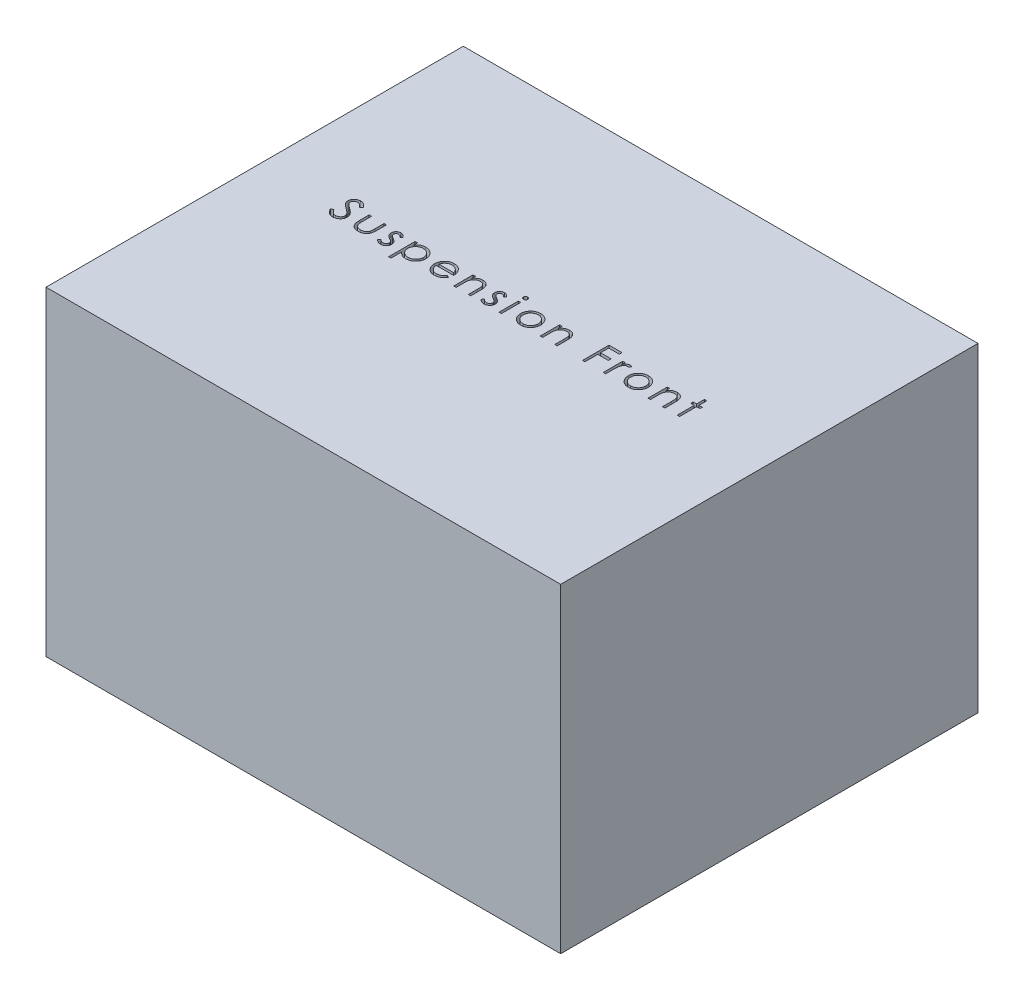
from build123d import *

# Parameters (mm, degrees)
BOSS_EXTRUDE1_DEPTH      = 115
BOSS_EXTRUDE1_DEPTH_BACK = 115
SKETCH1_W                = 370
SKETCH1_H                = 300
SKETCH2_W                = 1.709615384
SKETCH2_H                = 13.921153846
CUT_EXTRUDE1_DEPTH       = 30


with BuildPart() as part:
    # Sketch1 → Boss-Extrude1 (new, two sides: drawn at the far end of the back side and taken through both)
    with BuildSketch(Plane(origin=(0, 0, 0), x_dir=(1, 0, 0), z_dir=(0, 1, 0)).offset(-BOSS_EXTRUDE1_DEPTH_BACK)):
        Rectangle(SKETCH1_W, SKETCH1_H)
    extrude(amount=BOSS_EXTRUDE1_DEPTH + BOSS_EXTRUDE1_DEPTH_BACK)

    # Sketch2 → Cut-Extrude1 (cut)
    # profile 1 of 16: a face of its own
    with BuildSketch(Plane(origin=(0, 115, 0), x_dir=(1, 0, 0), z_dir=(0, 1, 0))):
        with BuildLine():
            Line((-131.479988393, 0.915421973), (-129.869591758, 1.880896732))
            add(Edge.make_bspline(
                [(-129.869591758, 1.880896732), (-129.719813924, 1.630174866), (-129.432845374, 1.149801445), (-128.95413869, 0.500696968), (-128.458115274, -0.051002771), (-127.941101901, -0.502088307), (-127.406254384, -0.857228676), (-126.850081177, -1.108700823), (-126.274456522, -1.26554206), (-125.882713293, -1.284592531), (-125.687139835, -1.294103268)],
                knots=[0, 0, 0, 0, 1.272034388, 2.437168799, 3.508375237, 4.49857839, 5.41946034, 6.295179144, 7.148887113, 8, 8, 8, 8], degree=3))
            add(Edge.make_bspline(
                [(-125.687139835, -1.294103268), (-125.520115637, -1.289451407), (-125.188989773, -1.280229083), (-124.701515279, -1.191615003), (-124.228085755, -1.055477559), (-123.778458741, -0.860509346), (-123.358838325, -0.624624159), (-122.99086474, -0.339711393), (-122.672750896, -0.020726188), (-122.412532715, 0.335142261), (-122.212888523, 0.717868456), (-122.059443122, 1.110711848), (-121.974289221, 1.519843627), (-121.961461749, 1.795309146), (-121.954988393, 1.934322213)],
                knots=[0, 0, 0, 0, 1.095163259, 2.171163733, 3.241058638, 4.321873601, 5.38011039, 6.391990106, 7.366004449, 8.327778327, 9.272591725, 10.192022065, 11.087607919, 12, 12, 12, 12], degree=3))
            add(Edge.make_bspline(
                [(-121.954988393, 1.934322213), (-121.963012855, 2.092931695), (-121.979325415, 2.415361595), (-122.117201042, 2.89106542), (-122.3340948, 3.361832123), (-122.534188618, 3.653031868), (-122.638071326, 3.80421404)],
                knots=[0, 0, 0, 0, 0.938893495, 1.908633276, 2.914225137, 4, 4, 4, 4], degree=3))
            add(Edge.make_bspline(
                [(-122.638071326, 3.80421404), (-122.72336424, 3.913326037), (-122.902426045, 4.142393027), (-123.210260506, 4.483362094), (-123.571481785, 4.835070917), (-123.973728277, 5.210949498), (-124.431652661, 5.593515935), (-124.930912418, 6.001013276), (-125.484254278, 6.417944717), (-125.872327253, 6.697558252), (-126.072566518, 6.841834232)],
                knots=[0, 0, 0, 0, 0.722233717, 1.516239348, 2.393582979, 3.351407094, 4.387010283, 5.505090956, 6.712668013, 8, 8, 8, 8], degree=3))
            add(Edge.make_bspline(
                [(-126.072566518, 6.841834232), (-126.272994269, 6.984592688), (-126.656196865, 7.257535984), (-127.192092864, 7.66261673), (-127.671306298, 8.032969791), (-128.091707231, 8.372081628), (-128.453110751, 8.679998234), (-128.758364745, 8.953762731), (-128.999693177, 9.20077897), (-129.13388998, 9.361023987), (-129.194141037, 9.43297005)],
                knots=[0, 0, 0, 0, 1.452282411, 2.77665338, 3.964542531, 5.026858415, 5.96415736, 6.766646006, 7.446254459, 8, 8, 8, 8], degree=3))
            add(Edge.make_bspline(
                [(-129.194141037, 9.43297005), (-129.278355891, 9.54509855), (-129.443975702, 9.765614295), (-129.662593532, 10.11028245), (-129.848408118, 10.463106223), (-129.994071668, 10.825033714), (-130.116733088, 11.190983827), (-130.199235539, 11.565731321), (-130.250895857, 11.947594659), (-130.256186241, 12.204570998), (-130.258834547, 12.333210434)],
                knots=[0, 0, 0, 0, 1.068054152, 2.10047183, 3.106115577, 4.101338837, 5.06977816, 6.043150881, 7.020423561, 8, 8, 8, 8], degree=3))
            add(Edge.make_bspline(
                [(-130.258834547, 12.333210434), (-130.251730481, 12.534758207), (-130.237674193, 12.933545811), (-130.118799378, 13.516099331), (-129.931168342, 14.072285402), (-129.668306167, 14.596597647), (-129.329448289, 15.075383915), (-128.937312342, 15.514151608), (-128.470252682, 15.88300632), (-127.957793404, 16.205289095), (-127.396872293, 16.457543345), (-126.809093233, 16.647830965), (-126.193522026, 16.755649925), (-125.776582108, 16.771122688), (-125.565024451, 16.778973656)],
                knots=[0, 0, 0, 0, 1.005424448, 1.989358655, 2.955360095, 3.929531133, 4.905563448, 5.876582895, 6.856512386, 7.866279853, 8.892233794, 9.918561126, 10.94386622, 12, 12, 12, 12], degree=3))
            add(Edge.make_bspline(
                [(-125.565024451, 16.778973656), (-125.340538705, 16.77123091), (-124.894108205, 16.755833062), (-124.23743176, 16.621952213), (-123.605185575, 16.40042427), (-123.096587233, 16.149026003), (-122.69853606, 15.897939298), (-122.394973044, 15.669231397), (-122.087356633, 15.405932592), (-121.773205506, 15.107341552), (-121.457842774, 14.770718521), (-121.136586555, 14.398368915), (-120.808685607, 13.992568232), (-120.597742996, 13.702874878), (-120.489603778, 13.554364281)],
                knots=[0, 0, 0, 0, 1.286793592, 2.559021753, 3.825965368, 5.121522368, 5.803751409, 6.523245864, 7.299691795, 8.125521123, 9.008227632, 9.944561021, 10.946284179, 12, 12, 12, 12], degree=3))
            Line((-120.489603778, 13.554364281), (-122.035126614, 12.382819809))
            add(Edge.make_bspline(
                [(-122.035126614, 12.382819809), (-122.128449475, 12.503045396), (-122.308167486, 12.734571765), (-122.581015121, 13.058809926), (-122.838182762, 13.35499105), (-123.091549938, 13.61224839), (-123.327735275, 13.844670002), (-123.556972319, 14.043659535), (-123.775962145, 14.211166705), (-124.052007045, 14.38992951), (-124.398813483, 14.567129907), (-124.834157887, 14.717075604), (-125.289106042, 14.807182441), (-125.598965893, 14.819096243), (-125.755829739, 14.825127502)],
                knots=[0, 0, 0, 0, 1.181633172, 2.275549214, 3.290209073, 4.226197932, 5.078386478, 5.862611352, 6.581680152, 7.217281963, 8.414376989, 9.595101626, 10.782541182, 12, 12, 12, 12], degree=3))
            add(Edge.make_bspline(
                [(-125.755829739, 14.825127502), (-125.952624525, 14.818532392), (-126.332124732, 14.805814344), (-126.870914446, 14.66691271), (-127.355839952, 14.448208584), (-127.772504628, 14.141694204), (-128.119415888, 13.778541372), (-128.370361314, 13.360645032), (-128.521401495, 12.899186527), (-128.539832532, 12.57728694), (-128.549219162, 12.413348656)],
                knots=[0, 0, 0, 0, 1.14458467, 2.207223713, 3.21896685, 4.227309161, 5.202851033, 6.127160689, 7.046193047, 8, 8, 8, 8], degree=3))
            add(Edge.make_bspline(
                [(-128.549219162, 12.413348656), (-128.54707943, 12.311287037), (-128.542796467, 12.106996908), (-128.483062211, 11.80518274), (-128.406321578, 11.504131021), (-128.284713825, 11.205195249), (-128.116827244, 10.90314738), (-127.896363358, 10.592786209), (-127.618705188, 10.271376194), (-127.406014592, 10.062330346), (-127.293720364, 9.951960434)],
                knots=[0, 0, 0, 0, 0.858281714, 1.717966888, 2.583508476, 3.4729293, 4.427298488, 5.488583878, 6.674047936, 8, 8, 8, 8], degree=3))
            add(Edge.make_bspline(
                [(-127.293720364, 9.951960434), (-127.252020609, 9.91474748), (-127.152951535, 9.826338017), (-126.971835424, 9.681600032), (-126.732661051, 9.503059229), (-126.441673928, 9.282148264), (-126.093508716, 9.025890591), (-125.688127132, 8.737562788), (-125.230047932, 8.40780479), (-124.904990075, 8.177258747), (-124.733113393, 8.055355867)],
                knots=[0, 0, 0, 0, 0.420754252, 0.999615792, 1.744751191, 2.668019286, 3.750313428, 4.999500688, 6.413464383, 8, 8, 8, 8], degree=3))
            add(Edge.make_bspline(
                [(-124.733113393, 8.055355867), (-124.526361493, 7.904907896), (-124.126015095, 7.613586251), (-123.556378839, 7.175895193), (-123.039885398, 6.747826624), (-122.57472139, 6.332114219), (-122.156291359, 5.931911313), (-121.78923748, 5.542403146), (-121.469819705, 5.166380243), (-121.125944245, 4.684292367), (-120.774565256, 4.092212465), (-120.472805051, 3.366798053), (-120.28253176, 2.638563794), (-120.257649654, 2.14910487), (-120.245373008, 1.907609473)],
                knots=[0, 0, 0, 0, 1.163667725, 2.253281268, 3.268753668, 4.215851969, 5.092017293, 5.902905408, 6.650798638, 7.335211899, 8.59617414, 9.77448103, 10.901945474, 12, 12, 12, 12], degree=3))
            add(Edge.make_bspline(
                [(-120.245373008, 1.907609473), (-120.248949717, 1.736821514), (-120.256033678, 1.398562184), (-120.337463794, 0.901873837), (-120.4567694, 0.419468675), (-120.636586345, -0.04269038), (-120.856059535, -0.493058303), (-121.134550113, -0.919821304), (-121.457353368, -1.332424702), (-121.827651432, -1.719866276), (-122.232849843, -2.075536286), (-122.661113952, -2.391924463), (-123.113144724, -2.655730623), (-123.586489961, -2.871000206), (-124.081258394, -3.039366923), (-124.597283618, -3.161356968), (-125.135416243, -3.236227337), (-125.501178864, -3.243998439), (-125.687139835, -3.247949421)],
                knots=[0, 0, 0, 0, 0.983748083, 1.948392443, 2.894712957, 3.844097841, 4.80183111, 5.778335162, 6.776009319, 7.81870978, 8.863265674, 9.881300176, 10.883814829, 11.87499822, 12.874611388, 13.892143829, 14.928324115, 16, 16, 16, 16], degree=3))
            add(Edge.make_bspline(
                [(-125.687139835, -3.247949421), (-125.831023631, -3.245167133), (-126.116979153, -3.239637596), (-126.539940762, -3.19075377), (-126.954357669, -3.12159082), (-127.355029689, -3.01178624), (-127.74711903, -2.87856155), (-128.128920406, -2.714522911), (-128.500618857, -2.517942143), (-128.864297415, -2.293179224), (-129.219031137, -2.031607785), (-129.561492812, -1.726952041), (-129.902918807, -1.387614363), (-130.233231636, -1.004379726), (-130.559112607, -0.583439589), (-130.874136522, -0.120855605), (-131.184824157, 0.380852563), (-131.379762632, 0.733903958), (-131.479988393, 0.915421973)],
                knots=[0, 0, 0, 0, 0.915332311, 1.819136955, 2.706846663, 3.586547465, 4.459518054, 5.340707479, 6.227863349, 7.133153174, 8.059268498, 9.028702269, 10.047606654, 11.120612155, 12.245963614, 13.433783089, 14.680604001, 16, 16, 16, 16], degree=3))
        make_face()
    # profile 2 of 16: a face of its own
    with BuildSketch(Plane(origin=(0, 115, 0), x_dir=(1, 0, 0), z_dir=(0, 1, 0))):
        with BuildLine():
            Line((-113.846526854, 11.161665963), (-112.13691147, 11.161665963))
            Line((-112.13691147, 11.161665963), (-112.13691147, 4.704815002))
            add(Edge.make_bspline(
                [(-112.13691147, 4.704815002), (-112.136139102, 4.515279753), (-112.134661598, 4.152707699), (-112.124641619, 3.630981611), (-112.101073538, 3.155184932), (-112.071606865, 2.725042808), (-112.033712953, 2.340628005), (-111.988627805, 2.003283219), (-111.938235538, 1.709182874), (-111.888908481, 1.532054038), (-111.86596796, 1.449676781)],
                knots=[0, 0, 0, 0, 1.388932606, 2.656963016, 3.823490214, 4.879454478, 5.816252168, 6.653371382, 7.373723809, 8, 8, 8, 8], degree=3))
            add(Edge.make_bspline(
                [(-111.86596796, 1.449676781), (-111.829166327, 1.346138011), (-111.756328156, 1.141213019), (-111.624211052, 0.845181433), (-111.460771106, 0.570995968), (-111.281919757, 0.3080838), (-111.075638695, 0.064232986), (-110.84453786, -0.160144683), (-110.59635317, -0.373526951), (-110.227572257, -0.625992747), (-109.723241109, -0.896586187), (-109.061102541, -1.130061998), (-108.343166683, -1.269594105), (-107.846970139, -1.28578255), (-107.591929499, -1.294103268)],
                knots=[0, 0, 0, 0, 0.725840625, 1.436591201, 2.137033971, 2.831655856, 3.53531722, 4.242432219, 4.957935707, 5.694543706, 7.190802206, 8.724350549, 10.316345118, 12, 12, 12, 12], degree=3))
            add(Edge.make_bspline(
                [(-107.591929499, -1.294103268), (-107.33691255, -1.285605614), (-106.843501938, -1.269164228), (-106.133454176, -1.134270968), (-105.484385764, -0.908905718), (-104.9028113, -0.594268234), (-104.391368656, -0.209229292), (-103.965168891, 0.242575796), (-103.613520834, 0.746853173), (-103.459980987, 1.123086748), (-103.382764835, 1.312296973)],
                knots=[0, 0, 0, 0, 1.157059328, 2.238695713, 3.266970494, 4.264342957, 5.228770407, 6.160125903, 7.074715775, 8, 8, 8, 8], degree=3))
            add(Edge.make_bspline(
                [(-103.382764835, 1.312296973), (-103.35993624, 1.388313541), (-103.309467792, 1.556367609), (-103.255244136, 1.841463096), (-103.206397423, 2.181449016), (-103.16468785, 2.578550123), (-103.134941751, 3.031728681), (-103.118906949, 3.540843067), (-103.100791622, 4.104295042), (-103.10051667, 4.498726703), (-103.100373008, 4.704815002)],
                knots=[0, 0, 0, 0, 0.557542046, 1.232589297, 2.036731608, 2.971723315, 4.038036528, 5.22795436, 6.551621927, 8, 8, 8, 8], degree=3))
            Line((-103.100373008, 4.704815002), (-103.100373008, 11.161665963))
            Line((-103.100373008, 11.161665963), (-101.390757624, 11.161665963))
            Line((-101.390757624, 11.161665963), (-101.390757624, 4.384262117))
            add(Edge.make_bspline(
                [(-101.390757624, 4.384262117), (-101.393161706, 4.153990227), (-101.397825953, 3.70723126), (-101.427801637, 3.057984882), (-101.479234529, 2.452944663), (-101.557299714, 1.891790338), (-101.649097172, 1.37495033), (-101.767513457, 0.901762232), (-101.908909294, 0.473683945), (-102.068415026, 0.083203702), (-102.256856905, -0.270837251), (-102.457301116, -0.606856481), (-102.688757374, -0.9165166), (-102.932435364, -1.215232232), (-103.203498662, -1.488145403), (-103.496867894, -1.741518435), (-103.80841388, -1.979224508), (-104.145050229, -2.191992758), (-104.501862514, -2.383671927), (-104.879291222, -2.553576581), (-105.281959226, -2.688029179), (-105.704671307, -2.804020088), (-106.149498492, -2.894994556), (-106.616011945, -2.959147155), (-107.104054528, -2.998473599), (-107.436664587, -3.001940943), (-107.607193922, -3.003718652)],
                knots=[0, 0, 0, 0, 1.493040784, 2.896703357, 4.213163133, 5.428574705, 6.569057535, 7.615249723, 8.588095153, 9.490268104, 10.346124644, 11.18633936, 12.024365274, 12.850166724, 13.684164916, 14.514361689, 15.362232829, 16.222528818, 17.093394965, 17.986930858, 18.902426812, 19.842810585, 20.827885679, 21.843828298, 22.894529745, 24, 24, 24, 24], degree=3))
            add(Edge.make_bspline(
                [(-107.607193922, -3.003718652), (-107.776447806, -3.001869675), (-108.109047444, -2.998236262), (-108.597115216, -2.959364423), (-109.064921202, -2.895094237), (-109.510802228, -2.803353697), (-109.935205733, -2.688841044), (-110.339850811, -2.552750373), (-110.719999346, -2.383583751), (-111.080218539, -2.193205902), (-111.417688681, -1.97785776), (-111.73396537, -1.741811716), (-112.028624525, -1.485420144), (-112.301731138, -1.209753815), (-112.549451768, -0.911393061), (-112.774873366, -0.59273794), (-112.98146629, -0.256945829), (-113.16844362, 0.102626526), (-113.32907189, 0.497625608), (-113.470886871, 0.934671237), (-113.586877631, 1.418554935), (-113.681270209, 1.948863003), (-113.757205907, 2.523057444), (-113.809926195, 3.144459818), (-113.839403789, 3.811556486), (-113.844101309, 4.272293744), (-113.846526854, 4.510193607)],
                knots=[0, 0, 0, 0, 1.083640291, 2.129454052, 3.13281866, 4.105697902, 5.042300162, 5.946461698, 6.836384745, 7.703652036, 8.553297018, 9.397182691, 10.228592656, 11.052265423, 11.879314572, 12.708807002, 13.549817954, 14.402308542, 15.300838682, 16.27712199, 17.341985831, 18.484375296, 19.725102775, 21.0496083, 22.476576903, 24, 24, 24, 24], degree=3))
            Line((-113.846526854, 4.510193607), (-113.846526854, 11.161665963))
        make_face()
    # profile 3 of 16: a face of its own
    with BuildSketch(Plane(origin=(0, 115, 0), x_dir=(1, 0, 0), z_dir=(0, 1, 0))):
        with BuildLine():
            Line((-87.664988393, 9.425337838), (-88.825084547, 8.230896732))
            add(Edge.make_bspline(
                [(-88.825084547, 8.230896732), (-88.92518143, 8.346901143), (-89.118156438, 8.570543991), (-89.424216356, 8.869558595), (-89.729144827, 9.120675363), (-90.028767655, 9.332686944), (-90.330619091, 9.492974442), (-90.631156888, 9.609967905), (-90.930692222, 9.682367732), (-91.130913357, 9.691699177), (-91.229231181, 9.696281348)],
                knots=[0, 0, 0, 0, 1.26578478, 2.440284043, 3.530471711, 4.527705817, 5.468200915, 6.346673037, 7.188140097, 8, 8, 8, 8], degree=3))
            add(Edge.make_bspline(
                [(-91.229231181, 9.696281348), (-91.349732718, 9.690430968), (-91.586862687, 9.678918248), (-91.926637498, 9.564000863), (-92.242054471, 9.387604729), (-92.515051748, 9.137404296), (-92.746306121, 8.850215918), (-92.915109156, 8.52910735), (-93.018338296, 8.183768712), (-93.031426909, 7.944120487), (-93.038065316, 7.822573415)],
                knots=[0, 0, 0, 0, 0.99966794, 1.967205029, 2.953328237, 3.988086729, 5.028030931, 6.008226631, 6.989793394, 8, 8, 8, 8], degree=3))
            add(Edge.make_bspline(
                [(-93.038065316, 7.822573415), (-93.032019324, 7.712562146), (-93.019944382, 7.492849729), (-92.926073171, 7.168738287), (-92.776579264, 6.852742122), (-92.636860064, 6.659178304), (-92.564868201, 6.559442406)],
                knots=[0, 0, 0, 0, 0.960159726, 1.917612774, 2.927026955, 4, 4, 4, 4], degree=3))
            add(Edge.make_bspline(
                [(-92.564868201, 6.559442406), (-92.521524042, 6.506186311), (-92.429271462, 6.392837425), (-92.256142259, 6.23551788), (-92.060076922, 6.061660771), (-91.82429269, 5.88783313), (-91.558947809, 5.704780454), (-91.258288277, 5.519711702), (-90.931855614, 5.318519618), (-90.698153988, 5.190914905), (-90.576677095, 5.124586636)],
                knots=[0, 0, 0, 0, 0.66740084, 1.420478572, 2.27185888, 3.217733974, 4.268547843, 5.408967954, 6.65319498, 8, 8, 8, 8], degree=3))
            add(Edge.make_bspline(
                [(-90.576677095, 5.124586636), (-90.428557482, 5.041610808), (-90.142439164, 4.88132883), (-89.735897102, 4.632537444), (-89.366941922, 4.385260692), (-89.032447502, 4.142143101), (-88.738849943, 3.896382493), (-88.477241449, 3.657398845), (-88.254147204, 3.417971324), (-88.12921226, 3.250695377), (-88.069495604, 3.170740482)],
                knots=[0, 0, 0, 0, 1.27191281, 2.456916733, 3.569705269, 4.599008579, 5.553216877, 6.436649441, 7.252746552, 8, 8, 8, 8], degree=3))
            add(Edge.make_bspline(
                [(-88.069495604, 3.170740482), (-87.970378305, 3.009272203), (-87.773116484, 2.68792036), (-87.565970777, 2.158774347), (-87.445899852, 1.597558613), (-87.429232625, 1.213661815), (-87.420757624, 1.018456829)],
                knots=[0, 0, 0, 0, 0.995354457, 1.980940102, 2.973342416, 4, 4, 4, 4], degree=3))
            add(Edge.make_bspline(
                [(-87.420757624, 1.018456829), (-87.424673943, 0.880920475), (-87.432391479, 0.609890067), (-87.486047529, 0.210739065), (-87.578331043, -0.170993312), (-87.704027047, -0.539449076), (-87.873759134, -0.887568447), (-88.072683573, -1.224134317), (-88.311488449, -1.541866169), (-88.584128651, -1.840346795), (-88.88264484, -2.112956363), (-89.201085393, -2.352572455), (-89.539842456, -2.551641347), (-89.896495476, -2.716371298), (-90.271854793, -2.847371387), (-90.665979096, -2.938063165), (-91.077615603, -2.992343479), (-91.357540701, -2.999878985), (-91.500174691, -3.003718652)],
                knots=[0, 0, 0, 0, 1.032770009, 2.035186124, 3.017557409, 3.978232242, 4.952395191, 5.920591857, 6.910227898, 7.931268572, 8.952309245, 9.941945286, 10.918353717, 11.897095711, 12.887975737, 13.898235213, 14.929059601, 16, 16, 16, 16], degree=3))
            add(Edge.make_bspline(
                [(-91.500174691, -3.003718652), (-91.692673174, -2.998315526), (-92.074995391, -2.98758435), (-92.640452291, -2.886858503), (-93.193015277, -2.730129287), (-93.728502833, -2.513961131), (-94.234939538, -2.240997965), (-94.698294999, -1.914086937), (-95.120178816, -1.544027094), (-95.360308278, -1.260383966), (-95.480373008, -1.118562402)],
                knots=[0, 0, 0, 0, 1.013940152, 2.01379169, 3.017749504, 4.037548394, 5.051665909, 6.043208538, 7.021604269, 8, 8, 8, 8], degree=3))
            Line((-95.480373008, -1.118562402), (-94.346989595, 0.171281348))
            add(Edge.make_bspline(
                [(-94.346989595, 0.171281348), (-94.239371176, 0.055050415), (-94.030736598, -0.170280822), (-93.697082832, -0.470314734), (-93.357560663, -0.721781652), (-93.015560441, -0.932112238), (-92.666019641, -1.094175504), (-92.310897084, -1.208032422), (-91.95091509, -1.28120724), (-91.709131751, -1.289797605), (-91.587945124, -1.294103268)],
                knots=[0, 0, 0, 0, 1.179806542, 2.287233372, 3.337373186, 4.324005949, 5.273901747, 6.200048787, 7.097828587, 8, 8, 8, 8], degree=3))
            add(Edge.make_bspline(
                [(-91.587945124, -1.294103268), (-91.422928984, -1.286642064), (-91.100515128, -1.272064123), (-90.63872267, -1.139709665), (-90.212336717, -0.932173784), (-89.842095365, -0.637798498), (-89.526942174, -0.29514031), (-89.298733111, 0.09083511), (-89.155715642, 0.508800039), (-89.138918992, 0.798535857), (-89.130373008, 0.945950819)],
                knots=[0, 0, 0, 0, 1.072336372, 2.095165389, 3.102688358, 4.141489647, 5.156069229, 6.117746104, 7.042326257, 8, 8, 8, 8], degree=3))
            add(Edge.make_bspline(
                [(-89.130373008, 0.945950819), (-89.136285553, 1.067378886), (-89.147959082, 1.307122351), (-89.239634605, 1.65410635), (-89.384484558, 1.983232006), (-89.527112716, 2.1758528), (-89.599754018, 2.273955627)],
                knots=[0, 0, 0, 0, 1.013901739, 2.00181326, 2.98231254, 4, 4, 4, 4], degree=3))
            add(Edge.make_bspline(
                [(-89.599754018, 2.273955627), (-89.643418765, 2.323133812), (-89.738536353, 2.430261661), (-89.913008452, 2.584975305), (-90.121915445, 2.751734102), (-90.367606903, 2.927710321), (-90.650578118, 3.11058273), (-90.971975977, 3.299391919), (-91.327397555, 3.503105684), (-91.578697706, 3.638195522), (-91.710060508, 3.708811396)],
                knots=[0, 0, 0, 0, 0.615000592, 1.339693406, 2.178160186, 3.116406724, 4.166410947, 5.330106347, 6.604359322, 8, 8, 8, 8], degree=3))
            add(Edge.make_bspline(
                [(-91.710060508, 3.708811396), (-91.851828649, 3.787945813), (-92.126762318, 3.941412701), (-92.516184001, 4.180441652), (-92.867506029, 4.423559247), (-93.189182014, 4.657127701), (-93.473086916, 4.893461696), (-93.718102292, 5.132823593), (-93.933874652, 5.365560089), (-94.053331279, 5.530463946), (-94.110391037, 5.609232069)],
                knots=[0, 0, 0, 0, 1.262093308, 2.447601706, 3.550203992, 4.582594899, 5.537233252, 6.418365656, 7.244515135, 8, 8, 8, 8], degree=3))
            add(Edge.make_bspline(
                [(-94.110391037, 5.609232069), (-94.209073301, 5.767867488), (-94.406472314, 6.085193762), (-94.598143569, 6.614840786), (-94.729893526, 7.172434598), (-94.741663107, 7.557173048), (-94.747680701, 7.753883511)],
                knots=[0, 0, 0, 0, 0.985009483, 1.970363186, 2.962279964, 4, 4, 4, 4], degree=3))
            add(Edge.make_bspline(
                [(-94.747680701, 7.753883511), (-94.744773152, 7.882473177), (-94.739082667, 8.134141372), (-94.693667186, 8.503922665), (-94.610980872, 8.855249046), (-94.507267651, 9.193396686), (-94.363124441, 9.511815226), (-94.1908803, 9.81475089), (-93.988474459, 10.101784958), (-93.755284547, 10.368502005), (-93.498889806, 10.61075991), (-93.221876845, 10.821935299), (-92.930475763, 11.002128459), (-92.623452794, 11.153250262), (-92.297858505, 11.267557787), (-91.955968774, 11.346247268), (-91.598475631, 11.398799158), (-91.354085217, 11.403496802), (-91.229231181, 11.405896732)],
                knots=[0, 0, 0, 0, 1.087655834, 2.128696564, 3.144119009, 4.137814668, 5.115653402, 6.093965665, 7.082169637, 8.081268856, 9.086088321, 10.061021666, 11.022561449, 11.980240094, 12.950172527, 13.934149372, 14.944599409, 16, 16, 16, 16], degree=3))
            add(Edge.make_bspline(
                [(-91.229231181, 11.405896732), (-91.081228665, 11.399885964), (-90.782447257, 11.387751671), (-90.334202793, 11.291382126), (-89.886618459, 11.132814802), (-89.438544226, 10.913814732), (-88.993262508, 10.630422165), (-88.546856474, 10.287906979), (-88.093967052, 9.888522561), (-87.811176262, 9.583182491), (-87.664988393, 9.425337838)],
                knots=[0, 0, 0, 0, 0.845714091, 1.707292901, 2.609013841, 3.555613372, 4.552488639, 5.621697636, 6.770543573, 8, 8, 8, 8], degree=3))
        make_face()
    # profile 4 of 16: a face of its own
    with BuildSketch(Plane(origin=(0, 115, 0), x_dir=(1, 0, 0), z_dir=(0, 1, 0))):
        with BuildLine():
            Line((-80.777680701, 11.161665963), (-79.068065316, 11.161665963))
            Line((-79.068065316, 11.161665963), (-79.068065316, 8.585794569))
            add(Edge.make_bspline(
                [(-79.068065316, 8.585794569), (-78.886505296, 8.81949852), (-78.53367973, 9.27365538), (-77.925577034, 9.861430223), (-77.28371826, 10.35714009), (-76.591585971, 10.745665019), (-75.85993703, 11.03860401), (-75.091773988, 11.255117873), (-74.280577282, 11.38270647), (-73.725969447, 11.398064369), (-73.443125412, 11.405896732)],
                knots=[0, 0, 0, 0, 1.0828784, 2.104357462, 3.088488658, 4.04616522, 5.001424249, 5.969181776, 6.964304535, 8, 8, 8, 8], degree=3))
            add(Edge.make_bspline(
                [(-73.443125412, 11.405896732), (-73.1960654, 11.398749287), (-72.707738308, 11.384621987), (-71.98893702, 11.288974361), (-71.296739575, 11.125048064), (-70.635062024, 10.888823081), (-69.996815912, 10.596784024), (-69.391449912, 10.228209873), (-68.809534702, 9.801456177), (-68.265705158, 9.310335471), (-67.763213143, 8.778958763), (-67.328621786, 8.207337365), (-66.95376185, 7.614269574), (-66.650756379, 6.990561186), (-66.413402374, 6.341123663), (-66.244593914, 5.663333149), (-66.144131597, 4.959702674), (-66.130652625, 4.481260723), (-66.123834547, 4.239250098)],
                knots=[0, 0, 0, 0, 1.041296284, 2.058176809, 3.050446431, 4.034000596, 5.01514041, 6.003636468, 7.015969324, 8.052561599, 9.08815499, 10.094063707, 11.074456064, 12.040834395, 13.011057502, 13.983766392, 14.980127149, 16, 16, 16, 16], degree=3))
            add(Edge.make_bspline(
                [(-66.123834547, 4.239250098), (-66.13050469, 3.992131818), (-66.143659174, 3.50477891), (-66.245685563, 2.789113423), (-66.40873655, 2.100660717), (-66.643096089, 1.440565897), (-66.945944762, 0.809283452), (-67.314451012, 0.207268639), (-67.74926164, -0.365285659), (-68.246200635, -0.900606444), (-68.785331615, -1.393725562), (-69.361607665, -1.825007055), (-69.966085531, -2.187182255), (-70.595672613, -2.489712363), (-71.255758588, -2.717725536), (-71.943263714, -2.882196708), (-72.657813682, -2.983621606), (-73.143867095, -2.996968267), (-73.389699931, -3.003718652)],
                knots=[0, 0, 0, 0, 1.038740735, 2.04854663, 3.033179607, 4.009277356, 4.987731542, 5.972001279, 6.972200261, 8.005528982, 9.039189865, 10.040446548, 11.026516639, 11.997840187, 12.972163198, 13.956796175, 14.96660207, 16, 16, 16, 16], degree=3))
            add(Edge.make_bspline(
                [(-73.389699931, -3.003718652), (-73.666347144, -2.996671199), (-74.212806497, -2.982750412), (-75.011805246, -2.841674766), (-75.780754968, -2.630835159), (-76.511136457, -2.322230637), (-77.208735551, -1.928954186), (-77.869606208, -1.449382922), (-78.49725882, -0.884519807), (-78.875040771, -0.455993779), (-79.068065316, -0.237041969)],
                knots=[0, 0, 0, 0, 1.014726462, 2.004382257, 2.969841629, 3.936926163, 4.907207904, 5.903978561, 6.929055279, 8, 8, 8, 8], degree=3))
            Line((-79.068065316, -0.237041969), (-79.068065316, -7.888334037))
            Line((-79.068065316, -7.888334037), (-80.777680701, -7.888334037))
            Line((-80.777680701, -7.888334037), (-80.777680701, 11.161665963))
        make_face()
        with BuildLine():
            add(Edge.make_bspline(
                [(-73.458389835, 9.696281348), (-73.652044311, 9.692796514), (-74.033300059, 9.685935774), (-74.592130279, 9.60443471), (-75.130403965, 9.48611929), (-75.6426963, 9.306984519), (-76.133917513, 9.08709955), (-76.600284181, 8.812333174), (-77.041468942, 8.487655828), (-77.456361778, 8.119286828), (-77.831174847, 7.713387454), (-78.162987355, 7.280202379), (-78.441701401, 6.82028019), (-78.673033826, 6.337905003), (-78.849073693, 5.829295665), (-78.974018396, 5.297348839), (-79.052560745, 4.74148229), (-79.062841961, 4.362898883), (-79.068065316, 4.170560194)],
                knots=[0, 0, 0, 0, 1.05670511, 2.080379991, 3.077984906, 4.06214886, 5.038337365, 6.01289324, 7.01187578, 8.025460281, 9.038092164, 10.024533457, 11.000252242, 11.969694649, 12.940728589, 13.933144304, 14.949937299, 16, 16, 16, 16], degree=3))
            add(Edge.make_bspline(
                [(-79.068065316, 4.170560194), (-79.059406514, 3.918076324), (-79.042443186, 3.42343904), (-78.904535512, 2.700714034), (-78.680097861, 2.016810023), (-78.361534433, 1.377486379), (-77.95904835, 0.789751233), (-77.474099813, 0.263478075), (-76.911076786, -0.198024999), (-76.279339642, -0.58676068), (-75.60212776, -0.902381441), (-74.895721581, -1.128337358), (-74.169835587, -1.267523344), (-73.679062304, -1.285195316), (-73.431677095, -1.294103268)],
                knots=[0, 0, 0, 0, 1.03728447, 2.032128127, 3.01272805, 3.987917167, 4.958271349, 5.931593992, 6.91984656, 7.941419022, 8.973179163, 9.983609215, 10.983593296, 12, 12, 12, 12], degree=3))
            add(Edge.make_bspline(
                [(-73.431677095, -1.294103268), (-73.189275272, -1.285632131), (-72.708151232, -1.268818446), (-71.999719171, -1.123286311), (-71.311248696, -0.900972677), (-70.657125186, -0.57679852), (-70.043043059, -0.179524062), (-69.488516318, 0.29705269), (-69.004064403, 0.849447953), (-68.591145556, 1.46453709), (-68.258415614, 2.124077392), (-68.00842388, 2.806510379), (-67.864141503, 3.509430467), (-67.843693839, 3.98294659), (-67.833449931, 4.220169569)],
                knots=[0, 0, 0, 0, 1.00104056, 1.986885549, 2.97790532, 3.984399681, 4.995088187, 5.994304198, 6.996462723, 8.023150851, 9.048424203, 10.043036403, 11.019596776, 12, 12, 12, 12], degree=3))
            add(Edge.make_bspline(
                [(-67.833449931, 4.220169569), (-67.84136784, 4.45886601), (-67.857141968, 4.934399205), (-68.012519416, 5.635237292), (-68.246017866, 6.320427562), (-68.586517849, 6.970960839), (-68.990384759, 7.584774061), (-69.478864842, 8.126631602), (-70.026504426, 8.601089121), (-70.639855447, 8.993058709), (-71.298116905, 9.304855474), (-71.991073805, 9.532822137), (-72.715211126, 9.669839259), (-73.208484503, 9.687389787), (-73.458389835, 9.696281348)],
                knots=[0, 0, 0, 0, 0.983928682, 1.960191568, 2.949917689, 3.96440592, 4.982380491, 5.975291189, 6.965713506, 7.964880129, 8.970154049, 9.96478489, 10.968906225, 12, 12, 12, 12], degree=3))
        make_face(mode=Mode.SUBTRACT)
    # profile 5 of 16: a face of its own
    with BuildSketch(Plane(origin=(0, 115, 0), x_dir=(1, 0, 0), z_dir=(0, 1, 0))):
        with BuildLine():
            Line((-48.055336951, 1.636665963), (-46.536526854, 0.839099857))
            add(Edge.make_bspline(
                [(-46.536526854, 0.839099857), (-46.657557466, 0.62441544), (-46.893035106, 0.20672458), (-47.297987748, -0.367125974), (-47.722487458, -0.883368542), (-48.185696198, -1.328211375), (-48.67375545, -1.716022484), (-49.189371757, -2.055318359), (-49.735229465, -2.344434877), (-50.311354396, -2.588016493), (-50.92258481, -2.775302453), (-51.57040192, -2.907586856), (-52.256046774, -2.989356361), (-52.726016696, -2.998854913), (-52.966665076, -3.003718652)],
                knots=[0, 0, 0, 0, 1.120438281, 2.179929193, 3.190490725, 4.156257408, 5.095198341, 6.022838206, 6.959905092, 7.901321166, 8.864066838, 9.862729781, 10.905609505, 12, 12, 12, 12], degree=3))
            add(Edge.make_bspline(
                [(-52.966665076, -3.003718652), (-53.234137839, -2.997474741), (-53.755899713, -2.985294678), (-54.515394623, -2.880288551), (-55.230474028, -2.708988998), (-55.901097728, -2.469690837), (-56.525623417, -2.157122116), (-57.105292355, -1.77634265), (-57.643152918, -1.329308521), (-58.122256113, -0.812147593), (-58.553569246, -0.258707226), (-58.934165495, 0.317995517), (-59.252340941, 0.916509639), (-59.511163005, 1.53302492), (-59.720195199, 2.16365554), (-59.865882544, 2.814139385), (-59.949864458, 3.482715922), (-59.962733797, 3.93500285), (-59.969219162, 4.162927982)],
                knots=[0, 0, 0, 0, 1.145258523, 2.234067595, 3.276747158, 4.290159414, 5.277019952, 6.260822364, 7.254936242, 8.264827045, 9.274100331, 10.257902744, 11.220704747, 12.172965371, 13.118907548, 14.062713208, 15.023725156, 16, 16, 16, 16], degree=3))
            add(Edge.make_bspline(
                [(-59.969219162, 4.162927982), (-59.963454407, 4.376804131), (-59.952029424, 4.800678413), (-59.880016139, 5.428052305), (-59.752390429, 6.037807168), (-59.577259294, 6.630449664), (-59.351101797, 7.204987507), (-59.07442929, 7.761770368), (-58.746810777, 8.300205772), (-58.493866652, 8.639857114), (-58.366454739, 8.810944809)],
                knots=[0, 0, 0, 0, 1.024358464, 2.0301432, 3.019427413, 4.004406732, 4.986367066, 5.972626655, 6.978780325, 8, 8, 8, 8], degree=3))
            add(Edge.make_bspline(
                [(-58.366454739, 8.810944809), (-58.193874351, 9.017059659), (-57.854180485, 9.422760164), (-57.279652322, 9.95582448), (-56.657532682, 10.402377028), (-55.995617974, 10.772530154), (-55.286215165, 11.053782433), (-54.53886031, 11.263373702), (-53.745043619, 11.380819734), (-53.202362346, 11.397408657), (-52.924687912, 11.405896732)],
                knots=[0, 0, 0, 0, 1.030682036, 2.02871468, 2.997146059, 3.962720338, 4.930598197, 5.918074684, 6.934738563, 8, 8, 8, 8], degree=3))
            add(Edge.make_bspline(
                [(-52.924687912, 11.405896732), (-52.639223089, 11.398526838), (-52.079206179, 11.384068784), (-51.262602777, 11.25003117), (-50.489930877, 11.037473694), (-49.761499675, 10.737279492), (-49.077235319, 10.349968217), (-48.441585535, 9.870224765), (-47.843679445, 9.312777748), (-47.49583418, 8.884080851), (-47.318828537, 8.66593279)],
                knots=[0, 0, 0, 0, 1.056321875, 2.072262726, 3.055038591, 4.01806755, 4.982017516, 5.957941055, 6.960871419, 8, 8, 8, 8], degree=3))
            add(Edge.make_bspline(
                [(-47.318828537, 8.66593279), (-47.198394773, 8.501539011), (-46.958328888, 8.173845708), (-46.657626815, 7.639514125), (-46.396601565, 7.080475033), (-46.187960734, 6.487691844), (-46.019017163, 5.868188129), (-45.896787907, 5.217535136), (-45.825107554, 4.535926618), (-45.811017645, 4.071506366), (-45.803834547, 3.834742886)],
                knots=[0, 0, 0, 0, 0.94817472, 1.890038105, 2.849395472, 3.817997239, 4.812318967, 5.836947057, 6.897266129, 8, 8, 8, 8], degree=3))
            Line((-45.803834547, 3.834742886), (-58.259603778, 3.834742886))
            add(Edge.make_bspline(
                [(-58.259603778, 3.834742886), (-58.25122392, 3.651316074), (-58.234745267, 3.290614645), (-58.157918559, 2.762816525), (-58.036821662, 2.26004162), (-57.866628621, 1.786061063), (-57.660524792, 1.334684226), (-57.408053962, 0.909259425), (-57.106848676, 0.511724406), (-56.770884512, 0.138523271), (-56.396921607, -0.193821729), (-56.00349694, -0.49128354), (-55.584976251, -0.740596859), (-55.144659539, -0.942961687), (-54.683258823, -1.101383208), (-54.200628732, -1.209520917), (-53.697718985, -1.281949599), (-53.354896632, -1.290003205), (-53.180366999, -1.294103268)],
                knots=[0, 0, 0, 0, 1.094153842, 2.151609401, 3.174256925, 4.172055639, 5.149267565, 6.128595816, 7.11444997, 8.118368179, 9.117203808, 10.09244225, 11.054858984, 12.015122123, 12.976791628, 13.957293641, 14.960065497, 16, 16, 16, 16], degree=3))
            add(Edge.make_bspline(
                [(-53.180366999, -1.294103268), (-53.009727181, -1.290793702), (-52.671145049, -1.284226889), (-52.166914097, -1.220371774), (-51.670854669, -1.117119274), (-51.185019889, -0.976203756), (-50.719269999, -0.804335461), (-50.287947791, -0.59694705), (-49.891271189, -0.367532), (-49.52052027, -0.105133626), (-49.160905292, 0.216039506), (-48.804166902, 0.616828216), (-48.421661117, 1.090833189), (-48.182232048, 1.447588885), (-48.055336951, 1.636665963)],
                knots=[0, 0, 0, 0, 0.99110716, 1.966546729, 2.947904876, 3.932708344, 4.903319531, 5.828989031, 6.710028674, 7.56322171, 8.463672341, 9.504779593, 10.677557249, 12, 12, 12, 12], degree=3))
        make_face()
        with BuildLine():
            add(Edge.make_bspline(
                [(-47.513449931, 5.544358271), (-47.576024416, 5.771123341), (-47.696460157, 6.207573104), (-47.948118084, 6.811952808), (-48.231536041, 7.349096955), (-48.566934322, 7.814894672), (-48.946947671, 8.228570935), (-49.38588788, 8.590077806), (-49.878117529, 8.913478504), (-50.42109228, 9.186451394), (-50.996085425, 9.418806196), (-51.598099127, 9.574608612), (-52.212367943, 9.68134055), (-52.627844559, 9.691279797), (-52.836917479, 9.696281348)],
                knots=[0, 0, 0, 0, 1.154881502, 2.222775134, 3.210006277, 4.132804581, 5.035138423, 5.962687519, 6.919655026, 7.923214229, 8.944639381, 9.960483929, 10.97369054, 12, 12, 12, 12], degree=3))
            add(Edge.make_bspline(
                [(-52.836917479, 9.696281348), (-53.007547995, 9.692952107), (-53.34484865, 9.686370898), (-53.841787322, 9.623940622), (-54.319015397, 9.520744895), (-54.780054177, 9.379421346), (-55.218862046, 9.191051666), (-55.644464999, 8.970162962), (-56.046041156, 8.700515198), (-56.297181635, 8.494999146), (-56.424056903, 8.391173175)],
                knots=[0, 0, 0, 0, 1.04873581, 2.073130211, 3.073294108, 4.04793562, 5.032784715, 6.005352987, 6.992311501, 8, 8, 8, 8], degree=3))
            add(Edge.make_bspline(
                [(-56.424056903, 8.391173175), (-56.514916052, 8.309016971), (-56.698792825, 8.142752838), (-56.944486235, 7.856299585), (-57.179729093, 7.54740894), (-57.393816546, 7.204263333), (-57.590181695, 6.830770236), (-57.773932428, 6.430079964), (-57.939321328, 5.999151927), (-58.032373013, 5.698856222), (-58.080246806, 5.544358271)],
                knots=[0, 0, 0, 0, 0.879870761, 1.780643979, 2.707998968, 3.669668524, 4.684282772, 5.740141944, 6.837334558, 8, 8, 8, 8], degree=3))
            Line((-58.080246806, 5.544358271), (-47.513449931, 5.544358271))
        make_face(mode=Mode.SUBTRACT)
    # profile 6 of 16: a face of its own
    with BuildSketch(Plane(origin=(0, 115, 0), x_dir=(1, 0, 0), z_dir=(0, 1, 0))):
        with BuildLine():
            Line((-39.160757624, 11.161665963), (-37.451142239, 11.161665963))
            Line((-37.451142239, 11.161665963), (-37.451142239, 8.650668367))
            add(Edge.make_bspline(
                [(-37.451142239, 8.650668367), (-37.268601682, 8.87841233), (-36.914375363, 9.320357435), (-36.32445492, 9.901222277), (-35.701008834, 10.379895573), (-35.047855072, 10.761460509), (-34.364106975, 11.049097146), (-33.653932391, 11.256828856), (-32.913079491, 11.381387709), (-32.409264484, 11.397663105), (-32.154387431, 11.405896732)],
                knots=[0, 0, 0, 0, 1.12780773, 2.188550248, 3.19190651, 4.159438251, 5.104880172, 6.052711206, 7.014878035, 8, 8, 8, 8], degree=3))
            add(Edge.make_bspline(
                [(-32.154387431, 11.405896732), (-31.896773551, 11.396397883), (-31.392561048, 11.377806343), (-30.658439029, 11.230758353), (-29.972783843, 10.979596322), (-29.338040261, 10.635542053), (-28.765847856, 10.207698247), (-28.263336879, 9.709253464), (-27.847702633, 9.135924211), (-27.5690427, 8.604031032), (-27.385478817, 8.132196309), (-27.269914238, 7.728081855), (-27.171774181, 7.277858775), (-27.08669281, 6.782887583), (-27.029123101, 6.23970029), (-26.9837172, 5.650523566), (-26.951176021, 5.015548256), (-26.949884937, 4.57638247), (-26.949219162, 4.349917165)],
                knots=[0, 0, 0, 0, 1.235846778, 2.418850247, 3.575807741, 4.728682307, 5.871620074, 6.994088408, 8.11269785, 9.256955736, 9.865816715, 10.540099792, 11.271859618, 12.076849838, 12.949306005, 13.892391288, 14.913166135, 16, 16, 16, 16], degree=3))
            Line((-26.949219162, 4.349917165), (-26.949219162, -2.759487883))
            Line((-26.949219162, -2.759487883), (-28.658834547, -2.759487883))
            Line((-28.658834547, -2.759487883), (-28.658834547, 3.788949617))
            add(Edge.make_bspline(
                [(-28.658834547, 3.788949617), (-28.65988615, 3.97848321), (-28.661897689, 4.341028717), (-28.668242138, 4.860108686), (-28.683535514, 5.330842777), (-28.705025617, 5.752105592), (-28.736480054, 6.123492616), (-28.769260376, 6.445760251), (-28.809346893, 6.718499332), (-28.845067892, 6.882683566), (-28.861088153, 6.956317406)],
                knots=[0, 0, 0, 0, 1.430800155, 2.736877192, 3.918605307, 4.986035426, 5.920637409, 6.731861385, 7.431261377, 8, 8, 8, 8], degree=3))
            add(Edge.make_bspline(
                [(-28.861088153, 6.956317406), (-28.918921403, 7.172459712), (-29.030232516, 7.588466779), (-29.305281767, 8.15275147), (-29.652613236, 8.632801607), (-30.076600102, 9.025649191), (-30.573146928, 9.331379031), (-31.140875805, 9.543508699), (-31.774308121, 9.67618525), (-32.219829832, 9.689395783), (-32.452043681, 9.696281348)],
                knots=[0, 0, 0, 0, 1.084156227, 2.086665306, 3.027808233, 3.945421172, 4.874247719, 5.839848303, 6.874090471, 8, 8, 8, 8], degree=3))
            add(Edge.make_bspline(
                [(-32.452043681, 9.696281348), (-32.589572074, 9.693690522), (-32.861737208, 9.688563346), (-33.265324913, 9.637121281), (-33.656797912, 9.552983116), (-34.04008505, 9.439398103), (-34.407520327, 9.283393466), (-34.770908826, 9.106340751), (-35.116567071, 8.885642626), (-35.451865561, 8.639676529), (-35.763810986, 8.367102558), (-36.054069513, 8.079477439), (-36.312812166, 7.773177367), (-36.547228813, 7.453137652), (-36.74958479, 7.114962934), (-36.926222312, 6.76191578), (-37.076095165, 6.393531513), (-37.150568105, 6.137852966), (-37.187830941, 6.009923175)],
                knots=[0, 0, 0, 0, 1.023777757, 2.026029729, 3.023749952, 4.003683103, 4.997618607, 5.993177895, 7.010360494, 8.046726602, 9.087585522, 10.09234134, 11.086953743, 12.070360549, 13.043493632, 14.017870808, 15.008233677, 16, 16, 16, 16], degree=3))
            add(Edge.make_bspline(
                [(-37.187830941, 6.009923175), (-37.209273885, 5.91600557), (-37.255954054, 5.711551856), (-37.306372218, 5.376030088), (-37.35213345, 4.987900081), (-37.390434611, 4.547614755), (-37.413868377, 4.053632606), (-37.439419308, 3.508063261), (-37.448721484, 2.908731274), (-37.450312725, 2.491472632), (-37.451142239, 2.273955627)],
                knots=[0, 0, 0, 0, 0.615963638, 1.340920617, 2.168419149, 3.115676021, 4.16674242, 5.331190069, 6.6087489, 8, 8, 8, 8], degree=3))
            Line((-37.451142239, 2.273955627), (-37.451142239, -2.759487883))
            Line((-37.451142239, -2.759487883), (-39.160757624, -2.759487883))
            Line((-39.160757624, -2.759487883), (-39.160757624, 11.161665963))
        make_face()
    # profile 7 of 16: a face of its own
    with BuildSketch(Plane(origin=(0, 115, 0), x_dir=(1, 0, 0), z_dir=(0, 1, 0))):
        with BuildLine():
            Line((-13.223449931, 9.425337838), (-14.383546085, 8.230896732))
            add(Edge.make_bspline(
                [(-14.383546085, 8.230896732), (-14.483642969, 8.346901143), (-14.676617976, 8.570543991), (-14.982677894, 8.869558595), (-15.287606365, 9.120675363), (-15.587229193, 9.332686944), (-15.889080629, 9.492974442), (-16.189618427, 9.609967905), (-16.48915376, 9.682367732), (-16.689374895, 9.691699177), (-16.78769272, 9.696281348)],
                knots=[0, 0, 0, 0, 1.26578478, 2.440284043, 3.530471711, 4.527705817, 5.468200915, 6.346673037, 7.188140097, 8, 8, 8, 8], degree=3))
            add(Edge.make_bspline(
                [(-16.78769272, 9.696281348), (-16.908194256, 9.690430968), (-17.145324225, 9.678918248), (-17.485099036, 9.564000863), (-17.80051601, 9.387604729), (-18.073513287, 9.137404296), (-18.304767659, 8.850215918), (-18.473570695, 8.52910735), (-18.576799834, 8.183768712), (-18.589888447, 7.944120487), (-18.596526854, 7.822573415)],
                knots=[0, 0, 0, 0, 0.99966794, 1.967205029, 2.953328237, 3.988086729, 5.028030931, 6.008226631, 6.989793394, 8, 8, 8, 8], degree=3))
            add(Edge.make_bspline(
                [(-18.596526854, 7.822573415), (-18.590480862, 7.712562146), (-18.578405921, 7.492849729), (-18.48453471, 7.168738287), (-18.335040802, 6.852742122), (-18.195321602, 6.659178304), (-18.123329739, 6.559442406)],
                knots=[0, 0, 0, 0, 0.960159726, 1.917612774, 2.927026955, 4, 4, 4, 4], degree=3))
            add(Edge.make_bspline(
                [(-18.123329739, 6.559442406), (-18.07998558, 6.506186311), (-17.987733001, 6.392837425), (-17.814603798, 6.23551788), (-17.618538461, 6.061660771), (-17.382754228, 5.88783313), (-17.117409348, 5.704780454), (-16.816749815, 5.519711702), (-16.490317152, 5.318519618), (-16.256615526, 5.190914905), (-16.135138633, 5.124586636)],
                knots=[0, 0, 0, 0, 0.66740084, 1.420478572, 2.27185888, 3.217733974, 4.268547843, 5.408967954, 6.65319498, 8, 8, 8, 8], degree=3))
            add(Edge.make_bspline(
                [(-16.135138633, 5.124586636), (-15.987019021, 5.041610808), (-15.700900702, 4.88132883), (-15.294358641, 4.632537444), (-14.92540346, 4.385260692), (-14.590909041, 4.142143101), (-14.297311481, 3.896382493), (-14.035702988, 3.657398845), (-13.812608743, 3.417971324), (-13.687673799, 3.250695377), (-13.627957143, 3.170740482)],
                knots=[0, 0, 0, 0, 1.27191281, 2.456916733, 3.569705269, 4.599008579, 5.553216877, 6.436649441, 7.252746552, 8, 8, 8, 8], degree=3))
            add(Edge.make_bspline(
                [(-13.627957143, 3.170740482), (-13.528839844, 3.009272203), (-13.331578023, 2.68792036), (-13.124432315, 2.158774347), (-13.004361391, 1.597558613), (-12.987694163, 1.213661815), (-12.979219162, 1.018456829)],
                knots=[0, 0, 0, 0, 0.995354457, 1.980940102, 2.973342416, 4, 4, 4, 4], degree=3))
            add(Edge.make_bspline(
                [(-12.979219162, 1.018456829), (-12.983135482, 0.880920475), (-12.990853018, 0.609890067), (-13.044509068, 0.210739065), (-13.136792582, -0.170993312), (-13.262488586, -0.539449076), (-13.432220672, -0.887568447), (-13.631145111, -1.224134317), (-13.869949988, -1.541866169), (-14.142590189, -1.840346795), (-14.441106378, -2.112956363), (-14.759546931, -2.352572455), (-15.098303995, -2.551641347), (-15.454957014, -2.716371298), (-15.830316331, -2.847371387), (-16.224440634, -2.938063165), (-16.636077141, -2.992343479), (-16.91600224, -2.999878985), (-17.058636229, -3.003718652)],
                knots=[0, 0, 0, 0, 1.032770009, 2.035186124, 3.017557409, 3.978232242, 4.952395191, 5.920591857, 6.910227898, 7.931268572, 8.952309245, 9.941945286, 10.918353717, 11.897095711, 12.887975737, 13.898235213, 14.929059601, 16, 16, 16, 16], degree=3))
            add(Edge.make_bspline(
                [(-17.058636229, -3.003718652), (-17.251134713, -2.998315526), (-17.63345693, -2.98758435), (-18.19891383, -2.886858503), (-18.751476816, -2.730129287), (-19.286964371, -2.513961131), (-19.793401077, -2.240997965), (-20.256756538, -1.914086937), (-20.678640355, -1.544027094), (-20.918769816, -1.260383966), (-21.038834547, -1.118562402)],
                knots=[0, 0, 0, 0, 1.013940152, 2.01379169, 3.017749504, 4.037548394, 5.051665909, 6.043208538, 7.021604269, 8, 8, 8, 8], degree=3))
            Line((-21.038834547, -1.118562402), (-19.905451133, 0.171281348))
            add(Edge.make_bspline(
                [(-19.905451133, 0.171281348), (-19.797832714, 0.055050415), (-19.589198136, -0.170280822), (-19.255544371, -0.470314734), (-18.916022202, -0.721781652), (-18.574021979, -0.932112238), (-18.22448118, -1.094175504), (-17.869358622, -1.208032422), (-17.509376629, -1.28120724), (-17.267593289, -1.289797605), (-17.146406662, -1.294103268)],
                knots=[0, 0, 0, 0, 1.179806542, 2.287233372, 3.337373186, 4.324005949, 5.273901747, 6.200048787, 7.097828587, 8, 8, 8, 8], degree=3))
            add(Edge.make_bspline(
                [(-17.146406662, -1.294103268), (-16.981390522, -1.286642064), (-16.658976666, -1.272064123), (-16.197184208, -1.139709665), (-15.770798256, -0.932173784), (-15.400556904, -0.637798498), (-15.085403713, -0.29514031), (-14.857194649, 0.09083511), (-14.71417718, 0.508800039), (-14.69738053, 0.798535857), (-14.688834547, 0.945950819)],
                knots=[0, 0, 0, 0, 1.072336372, 2.095165389, 3.102688358, 4.141489647, 5.156069229, 6.117746104, 7.042326257, 8, 8, 8, 8], degree=3))
            add(Edge.make_bspline(
                [(-14.688834547, 0.945950819), (-14.694747092, 1.067378886), (-14.70642062, 1.307122351), (-14.798096143, 1.65410635), (-14.942946096, 1.983232006), (-15.085574254, 2.1758528), (-15.158215556, 2.273955627)],
                knots=[0, 0, 0, 0, 1.013901739, 2.00181326, 2.98231254, 4, 4, 4, 4], degree=3))
            add(Edge.make_bspline(
                [(-15.158215556, 2.273955627), (-15.201880303, 2.323133812), (-15.296997892, 2.430261661), (-15.471469991, 2.584975305), (-15.680376984, 2.751734102), (-15.926068442, 2.927710321), (-16.209039656, 3.11058273), (-16.530437515, 3.299391919), (-16.885859094, 3.503105684), (-17.137159244, 3.638195522), (-17.268522047, 3.708811396)],
                knots=[0, 0, 0, 0, 0.615000592, 1.339693406, 2.178160186, 3.116406724, 4.166410947, 5.330106347, 6.604359322, 8, 8, 8, 8], degree=3))
            add(Edge.make_bspline(
                [(-17.268522047, 3.708811396), (-17.410290188, 3.787945813), (-17.685223856, 3.941412701), (-18.07464554, 4.180441652), (-18.425967568, 4.423559247), (-18.747643552, 4.657127701), (-19.031548454, 4.893461696), (-19.27656383, 5.132823593), (-19.492336191, 5.365560089), (-19.611792817, 5.530463946), (-19.668852576, 5.609232069)],
                knots=[0, 0, 0, 0, 1.262093308, 2.447601706, 3.550203992, 4.582594899, 5.537233252, 6.418365656, 7.244515135, 8, 8, 8, 8], degree=3))
            add(Edge.make_bspline(
                [(-19.668852576, 5.609232069), (-19.767534839, 5.767867488), (-19.964933853, 6.085193762), (-20.156605107, 6.614840786), (-20.288355065, 7.172434598), (-20.300124645, 7.557173048), (-20.306142239, 7.753883511)],
                knots=[0, 0, 0, 0, 0.985009483, 1.970363186, 2.962279964, 4, 4, 4, 4], degree=3))
            add(Edge.make_bspline(
                [(-20.306142239, 7.753883511), (-20.30323469, 7.882473177), (-20.297544205, 8.134141372), (-20.252128725, 8.503922665), (-20.169442411, 8.855249046), (-20.065729189, 9.193396686), (-19.921585979, 9.511815226), (-19.749341838, 9.81475089), (-19.546935997, 10.101784958), (-19.313746085, 10.368502005), (-19.057351345, 10.61075991), (-18.780338384, 10.821935299), (-18.488937302, 11.002128459), (-18.181914332, 11.153250262), (-17.856320044, 11.267557787), (-17.514430312, 11.346247268), (-17.156937169, 11.398799158), (-16.912546755, 11.403496802), (-16.78769272, 11.405896732)],
                knots=[0, 0, 0, 0, 1.087655834, 2.128696564, 3.144119009, 4.137814668, 5.115653402, 6.093965665, 7.082169637, 8.081268856, 9.086088321, 10.061021666, 11.022561449, 11.980240094, 12.950172527, 13.934149372, 14.944599409, 16, 16, 16, 16], degree=3))
            add(Edge.make_bspline(
                [(-16.78769272, 11.405896732), (-16.639690203, 11.399885964), (-16.340908796, 11.387751671), (-15.892664331, 11.291382126), (-15.445079998, 11.132814802), (-14.997005764, 10.913814732), (-14.551724046, 10.630422165), (-14.105318012, 10.287906979), (-13.65242859, 9.888522561), (-13.3696378, 9.583182491), (-13.223449931, 9.425337838)],
                knots=[0, 0, 0, 0, 0.845714091, 1.707292901, 2.609013841, 3.555613372, 4.552488639, 5.621697636, 6.770543573, 8, 8, 8, 8], degree=3))
        make_face()
    # profile 8 of 16: a face of its own
    with BuildSketch(Plane(origin=(0, 115, 0), x_dir=(1, 0, 0), z_dir=(0, 1, 0))):
        with BuildLine():
            add(Edge.make_bspline(
                [(-5.733197528, 17.023204425), (-5.62710908, 17.018283252), (-5.419367525, 17.008646652), (-5.118958454, 16.926124898), (-4.845416716, 16.786245182), (-4.602786485, 16.598577204), (-4.39458693, 16.377872376), (-4.248823349, 16.120637677), (-4.155138736, 15.8427328), (-4.143825457, 15.648884958), (-4.138065316, 15.550187598)],
                knots=[0, 0, 0, 0, 1.055194115, 2.066272739, 3.074728998, 4.095836921, 5.109056067, 6.073838105, 7.019297344, 8, 8, 8, 8], degree=3))
            add(Edge.make_bspline(
                [(-4.138065316, 15.550187598), (-4.143955357, 15.4540523), (-4.155599272, 15.264004193), (-4.248750987, 14.990917152), (-4.395829167, 14.737256695), (-4.602652979, 14.516980401), (-4.845452093, 14.329416169), (-5.118949056, 14.189508947), (-5.419369997, 14.106994486), (-5.627109916, 14.09735688), (-5.733197528, 14.092435194)],
                knots=[0, 0, 0, 0, 0.96129708, 1.900370562, 2.859976407, 3.87933698, 4.906634145, 5.921202961, 6.938410037, 8, 8, 8, 8], degree=3))
            add(Edge.make_bspline(
                [(-5.733197528, 14.092435194), (-5.838071997, 14.097168957), (-6.042196449, 14.106382608), (-6.338107405, 14.19112799), (-6.609316754, 14.329464045), (-6.852420187, 14.515752281), (-7.05505881, 14.738609508), (-7.202551123, 14.99076235), (-7.295487702, 15.264043606), (-7.307160609, 15.454065539), (-7.313065316, 15.550187598)],
                knots=[0, 0, 0, 0, 1.054934014, 2.053291228, 3.073705704, 4.106921865, 5.123545215, 6.088680038, 7.033164197, 8, 8, 8, 8], degree=3))
            add(Edge.make_bspline(
                [(-7.313065316, 15.550187598), (-7.307289973, 15.648871222), (-7.295946835, 15.842692087), (-7.20248146, 16.120795052), (-7.056287364, 16.376508654), (-6.852286011, 16.599804587), (-6.609352463, 16.786197596), (-6.338098178, 16.924505938), (-6.042198886, 17.009258514), (-5.838072824, 17.018471172), (-5.733197528, 17.023204425)],
                knots=[0, 0, 0, 0, 0.98631895, 1.937192651, 2.907499808, 3.917963147, 4.944918757, 5.95915025, 6.951458133, 8, 8, 8, 8], degree=3))
        make_face()
    # profile 9 of 16: a face of its own
    with BuildSketch(Plane(origin=(0, 115, 0), x_dir=(1, 0, 0), z_dir=(0, 1, 0))):
        with Locations((-5.725565316, 4.20108904)):
            Rectangle(SKETCH2_W, SKETCH2_H)
    # profile 10 of 16: a face of its own
    with BuildSketch(Plane(origin=(0, 115, 0), x_dir=(1, 0, 0), z_dir=(0, 1, 0))):
        with BuildLine():
            add(Edge.make_bspline(
                [(9.228989972, 11.405896732), (9.490199615, 11.400334725), (10.002367887, 11.389428988), (10.752436523, 11.272870389), (11.468417905, 11.094631163), (12.15305418, 10.848224518), (12.797577159, 10.51794133), (13.411374931, 10.123827902), (13.992764651, 9.6569255), (14.341232853, 9.295748014), (14.518112569, 9.112417165)],
                knots=[0, 0, 0, 0, 1.054011418, 2.066658804, 3.057071809, 4.030435133, 4.997543892, 5.974964718, 6.972108034, 8, 8, 8, 8], degree=3))
            add(Edge.make_bspline(
                [(14.518112569, 9.112417165), (14.670414347, 8.937081042), (14.972070445, 8.589802034), (15.358871, 8.026707912), (15.692091206, 7.44355965), (15.959133894, 6.832613487), (16.169690952, 6.199202776), (16.319182813, 5.541150401), (16.408102416, 4.859909626), (16.42009285, 4.397245879), (16.426165453, 4.162927982)],
                knots=[0, 0, 0, 0, 1.025258237, 2.030674902, 3.01204498, 3.988269485, 4.97094183, 5.956517959, 6.965070386, 8, 8, 8, 8], degree=3))
            add(Edge.make_bspline(
                [(16.426165453, 4.162927982), (16.420824174, 3.927251954), (16.410269558, 3.461545131), (16.310427875, 2.775639726), (16.15513725, 2.110550763), (15.932895388, 1.46906273), (15.647917679, 0.849214769), (15.300169794, 0.253714222), (14.887211421, -0.318613818), (14.419103953, -0.862909537), (13.90175017, -1.364557078), (13.340503705, -1.801772373), (12.746393893, -2.176358099), (12.111520784, -2.47809059), (11.441682035, -2.715996244), (10.73543285, -2.883092048), (9.993870396, -2.984120641), (9.487536519, -2.99709409), (9.228989972, -3.003718652)],
                knots=[0, 0, 0, 0, 0.998656419, 1.973391657, 2.932242238, 3.890759089, 4.846373663, 5.82037756, 6.809684879, 7.83454468, 8.860553229, 9.859544525, 10.845671541, 11.83227036, 12.833544569, 13.85385346, 14.904124723, 16, 16, 16, 16], degree=3))
            add(Edge.make_bspline(
                [(9.228989972, -3.003718652), (8.969176713, -2.997071856), (8.46031932, -2.984053769), (7.716139332, -2.883484558), (7.008624407, -2.716073253), (6.337908749, -2.477308757), (5.700306082, -2.176348455), (5.102753863, -1.80290483), (4.541051465, -1.364427414), (4.023588236, -0.862944671), (3.555510113, -0.318604765), (3.142544167, 0.253711873), (2.794798249, 0.849215381), (2.509820025, 1.469062566), (2.287578301, 2.110550807), (2.132287639, 2.775639714), (2.032445966, 3.461545135), (2.021891348, 3.927251955), (2.016550069, 4.162927982)],
                knots=[0, 0, 0, 0, 1.099876186, 2.154163076, 3.173186993, 4.173200201, 5.163417411, 6.152872554, 7.150605724, 8.17532212, 9.198891216, 10.186952605, 11.159729845, 12.11414092, 13.071450619, 14.029093627, 15.002601286, 16, 16, 16, 16], degree=3))
            add(Edge.make_bspline(
                [(2.016550069, 4.162927982), (2.022664086, 4.395972325), (2.034768791, 4.857360072), (2.12359899, 5.537320217), (2.272507705, 6.194258863), (2.483317163, 6.825224668), (2.752821273, 7.433493541), (3.08135914, 8.018082693), (3.472105297, 8.578630578), (3.772561634, 8.925460757), (3.924602953, 9.100968848)],
                knots=[0, 0, 0, 0, 1.031353054, 2.041901799, 3.029428768, 4.008703097, 4.981709435, 5.96992636, 6.972712378, 8, 8, 8, 8], degree=3))
            add(Edge.make_bspline(
                [(3.924602953, 9.100968848), (4.101215999, 9.285889589), (4.448556629, 9.649568764), (5.032840419, 10.115110073), (5.645128216, 10.517424704), (6.296773886, 10.841145248), (6.980847727, 11.096080609), (7.700498175, 11.273330055), (8.453112052, 11.38900903), (8.967786562, 11.400211398), (9.228989972, 11.405896732)],
                knots=[0, 0, 0, 0, 1.027980169, 2.021703884, 2.998553061, 3.971491411, 4.943284454, 5.930300938, 6.949603206, 8, 8, 8, 8], degree=3))
        make_face()
        with BuildLine():
            add(Edge.make_bspline(
                [(9.221357761, 9.696281348), (9.036640191, 9.691031213), (8.671973505, 9.680666475), (8.135201194, 9.601832651), (7.618455499, 9.476932665), (7.120756047, 9.299473444), (6.643781209, 9.070335151), (6.187074318, 8.788893934), (5.749292038, 8.458877413), (5.338998236, 8.080802015), (4.962448794, 7.667803488), (4.633275807, 7.22775742), (4.3533763, 6.76780145), (4.120203435, 6.287457272), (3.946537168, 5.781857133), (3.820409717, 5.25672684), (3.741650266, 4.710996502), (3.731382976, 4.340005817), (3.726165453, 4.151479665)],
                knots=[0, 0, 0, 0, 1.021534396, 2.016698045, 2.994645724, 3.958388632, 4.93408049, 5.916473867, 6.921342795, 7.962252576, 8.998418191, 10.008913653, 10.997312074, 11.973003931, 12.956656626, 13.948281152, 14.957379055, 16, 16, 16, 16], degree=3))
            add(Edge.make_bspline(
                [(3.726165453, 4.151479665), (3.734911165, 3.907900774), (3.752269767, 3.424442224), (3.893431554, 2.712455971), (4.129576877, 2.02893189), (4.448459071, 1.377876989), (4.847998632, 0.77550359), (5.318735381, 0.238448797), (5.855617179, -0.225205406), (6.45224413, -0.609911151), (7.096429774, -0.915580678), (7.778182036, -1.132200817), (8.489240671, -1.273016743), (8.975182936, -1.287012911), (9.221357761, -1.294103268)],
                knots=[0, 0, 0, 0, 1.016792936, 2.018143844, 3.017858371, 4.030088057, 5.03801393, 6.028138512, 7.003788237, 7.991172063, 8.984598303, 9.972568034, 10.972917682, 12, 12, 12, 12], degree=3))
            add(Edge.make_bspline(
                [(9.221357761, -1.294103268), (9.467518426, -1.286971599), (9.953432741, -1.272893884), (10.663503404, -1.132910022), (11.343392308, -0.914631526), (11.98690886, -0.610254927), (12.58326423, -0.223744498), (13.124007305, 0.23583064), (13.590724745, 0.776926031), (13.989869081, 1.378674867), (14.313973494, 2.027922554), (14.549013493, 2.712582125), (14.690514639, 3.424410096), (14.707827435, 3.907890011), (14.716550069, 4.151479665)],
                knots=[0, 0, 0, 0, 1.02726834, 2.027799167, 3.010890988, 4.004497153, 4.992059811, 5.971914811, 6.958719428, 7.966827853, 8.981595046, 9.981490638, 10.983022906, 12, 12, 12, 12], degree=3))
            add(Edge.make_bspline(
                [(14.716550069, 4.151479665), (14.711334342, 4.340006944), (14.701070588, 4.710999846), (14.622285424, 5.256714058), (14.49625313, 5.781904034), (14.322236184, 6.287284223), (14.090076481, 6.769045139), (13.804779364, 7.226406939), (13.476950497, 7.669327854), (13.09585731, 8.079466956), (12.685991782, 8.459024798), (12.248032074, 8.789021904), (11.792002405, 9.069098245), (11.316413263, 9.301433354), (10.818650001, 9.475318164), (10.302628341, 9.602553829), (9.768146247, 9.680333328), (9.404786312, 9.690931341), (9.221357761, 9.696281348)],
                knots=[0, 0, 0, 0, 1.042956736, 2.052379634, 3.044323526, 4.02829302, 5.004299113, 5.996692471, 7.007513377, 8.048758398, 9.090003419, 10.095195979, 11.07790575, 12.047570684, 13.018257071, 13.989683339, 14.985167495, 16, 16, 16, 16], degree=3))
        make_face(mode=Mode.SUBTRACT)
    # profile 11 of 16: a face of its own
    with BuildSketch(Plane(origin=(0, 115, 0), x_dir=(1, 0, 0), z_dir=(0, 1, 0))):
        with BuildLine():
            Line((23.069242376, 11.161665963), (24.778857761, 11.161665963))
            Line((24.778857761, 11.161665963), (24.778857761, 8.650668367))
            add(Edge.make_bspline(
                [(24.778857761, 8.650668367), (24.961398318, 8.87841233), (25.315624637, 9.320357435), (25.90554508, 9.901222277), (26.528991166, 10.379895573), (27.182144928, 10.761460509), (27.865893025, 11.049097146), (28.576067609, 11.256828856), (29.316920509, 11.381387709), (29.820735516, 11.397663105), (30.075612569, 11.405896732)],
                knots=[0, 0, 0, 0, 1.12780773, 2.188550248, 3.19190651, 4.159438251, 5.104880172, 6.052711206, 7.014878035, 8, 8, 8, 8], degree=3))
            add(Edge.make_bspline(
                [(30.075612569, 11.405896732), (30.333226449, 11.396397883), (30.837438952, 11.377806343), (31.571560971, 11.230758353), (32.257216157, 10.979596322), (32.891959739, 10.635542053), (33.464152144, 10.207698247), (33.966663121, 9.709253464), (34.382297367, 9.135924211), (34.6609573, 8.604031032), (34.844521183, 8.132196309), (34.960085762, 7.728081855), (35.058225819, 7.277858775), (35.14330719, 6.782887583), (35.200876899, 6.23970029), (35.2462828, 5.650523566), (35.278823979, 5.015548256), (35.280115063, 4.57638247), (35.280780838, 4.349917165)],
                knots=[0, 0, 0, 0, 1.235846778, 2.418850247, 3.575807741, 4.728682307, 5.871620074, 6.994088408, 8.11269785, 9.256955736, 9.865816715, 10.540099792, 11.271859618, 12.076849838, 12.949306005, 13.892391288, 14.913166135, 16, 16, 16, 16], degree=3))
            Line((35.280780838, 4.349917165), (35.280780838, -2.759487883))
            Line((35.280780838, -2.759487883), (33.571165453, -2.759487883))
            Line((33.571165453, -2.759487883), (33.571165453, 3.788949617))
            add(Edge.make_bspline(
                [(33.571165453, 3.788949617), (33.57011385, 3.97848321), (33.568102311, 4.341028717), (33.561757862, 4.860108686), (33.546464486, 5.330842777), (33.524974383, 5.752105592), (33.493519946, 6.123492616), (33.460739624, 6.445760251), (33.420653107, 6.718499332), (33.384932108, 6.882683566), (33.368911847, 6.956317406)],
                knots=[0, 0, 0, 0, 1.430800155, 2.736877192, 3.918605307, 4.986035426, 5.920637409, 6.731861385, 7.431261377, 8, 8, 8, 8], degree=3))
            add(Edge.make_bspline(
                [(33.368911847, 6.956317406), (33.311078597, 7.172459712), (33.199767484, 7.588466779), (32.924718233, 8.15275147), (32.577386764, 8.632801607), (32.153399898, 9.025649191), (31.656853072, 9.331379031), (31.089124195, 9.543508699), (30.455691879, 9.67618525), (30.010170168, 9.689395783), (29.777956319, 9.696281348)],
                knots=[0, 0, 0, 0, 1.084156227, 2.086665306, 3.027808233, 3.945421172, 4.874247719, 5.839848303, 6.874090471, 8, 8, 8, 8], degree=3))
            add(Edge.make_bspline(
                [(29.777956319, 9.696281348), (29.640427926, 9.693690522), (29.368262792, 9.688563346), (28.964675087, 9.637121281), (28.573202088, 9.552983116), (28.18991495, 9.439398103), (27.822479673, 9.283393466), (27.459091174, 9.106340751), (27.113432929, 8.885642626), (26.778134439, 8.639676529), (26.466189014, 8.367102558), (26.175930487, 8.079477439), (25.917187834, 7.773177367), (25.682771187, 7.453137652), (25.48041521, 7.114962934), (25.303777688, 6.76191578), (25.153904835, 6.393531513), (25.079431895, 6.137852966), (25.042169059, 6.009923175)],
                knots=[0, 0, 0, 0, 1.023777757, 2.026029729, 3.023749952, 4.003683103, 4.997618607, 5.993177895, 7.010360494, 8.046726602, 9.087585522, 10.09234134, 11.086953743, 12.070360549, 13.043493632, 14.017870808, 15.008233677, 16, 16, 16, 16], degree=3))
            add(Edge.make_bspline(
                [(25.042169059, 6.009923175), (25.020726115, 5.91600557), (24.974045946, 5.711551856), (24.923627782, 5.376030088), (24.87786655, 4.987900081), (24.839565389, 4.547614755), (24.816131623, 4.053632606), (24.790580692, 3.508063261), (24.781278516, 2.908731274), (24.779687275, 2.491472632), (24.778857761, 2.273955627)],
                knots=[0, 0, 0, 0, 0.615963638, 1.340920617, 2.168419149, 3.115676021, 4.16674242, 5.331190069, 6.6087489, 8, 8, 8, 8], degree=3))
            Line((24.778857761, 2.273955627), (24.778857761, -2.759487883))
            Line((24.778857761, -2.759487883), (23.069242376, -2.759487883))
            Line((23.069242376, -2.759487883), (23.069242376, 11.161665963))
        make_face()
    # profile 12 of 16: a face of its own
    with BuildSketch(Plane(origin=(0, 115, 0), x_dir=(1, 0, 0), z_dir=(0, 1, 0))):
        Polygon((53.451550069, 16.290512117), (62.732319299, 16.290512117), (62.732319299, 14.336665963), (55.161165453, 14.336665963), (55.161165453, 8.475127502), (62.732319299, 8.475127502), (62.732319299, 6.521281348), (55.161165453, 6.521281348), (55.161165453, -2.759487883), (53.451550069, -2.759487883), align=None)
    # profile 13 of 16: a face of its own
    with BuildSketch(Plane(origin=(0, 115, 0), x_dir=(1, 0, 0), z_dir=(0, 1, 0))):
        with BuildLine():
            Line((68.398473146, 11.161665963), (70.10808853, 11.161665963))
            Line((70.10808853, 11.161665963), (70.10808853, 9.112417165))
            add(Edge.make_bspline(
                [(70.10808853, 9.112417165), (70.234301631, 9.303221031), (70.475683207, 9.668131941), (70.876892151, 10.150746279), (71.287845997, 10.55033389), (71.710512088, 10.868760185), (72.147998603, 11.107228732), (72.590704011, 11.281906537), (73.045593355, 11.385197353), (73.351274685, 11.398987697), (73.504422665, 11.405896732)],
                knots=[0, 0, 0, 0, 1.2804753, 2.448899062, 3.506932113, 4.484331642, 5.4025378, 6.288909075, 7.142734305, 8, 8, 8, 8], degree=3))
            add(Edge.make_bspline(
                [(73.504422665, 11.405896732), (73.623220242, 11.399416866), (73.867653977, 11.38608412), (74.237673501, 11.292408061), (74.618910004, 11.142849109), (74.864613569, 11.002204469), (74.992703915, 10.928883511)],
                knots=[0, 0, 0, 0, 0.901110191, 1.854092781, 2.881294221, 4, 4, 4, 4], degree=3))
            Line((74.992703915, 10.928883511), (74.053941896, 9.448234473))
            add(Edge.make_bspline(
                [(74.053941896, 9.448234473), (73.971705652, 9.484920778), (73.815605519, 9.554558409), (73.587252808, 9.636974207), (73.376715818, 9.685502264), (73.24258445, 9.692854026), (73.180053674, 9.696281348)],
                knots=[0, 0, 0, 0, 1.180555205, 2.24091978, 3.179933427, 4, 4, 4, 4], degree=3))
            add(Edge.make_bspline(
                [(73.180053674, 9.696281348), (73.042862468, 9.687137144), (72.763032174, 9.66848562), (72.352180827, 9.521861538), (71.953506751, 9.284959874), (71.636886703, 9.022227108), (71.391728156, 8.768874096), (71.2167935, 8.547630648), (71.05632312, 8.299552668), (70.902996634, 8.028881103), (70.763298662, 7.730994369), (70.632916819, 7.408868594), (70.515030722, 7.062130678), (70.447810107, 6.820562961), (70.413376992, 6.696822213)],
                knots=[0, 0, 0, 0, 1.125678352, 2.296057538, 3.5422874, 4.923748041, 5.663163013, 6.437101912, 7.23742474, 8.08941207, 8.991984279, 9.93940061, 10.944477711, 12, 12, 12, 12], degree=3))
            add(Edge.make_bspline(
                [(70.413376992, 6.696822213), (70.387619251, 6.586456454), (70.330567812, 6.342004684), (70.275096727, 5.931893428), (70.220289779, 5.447350371), (70.181663899, 4.887026773), (70.145860556, 4.2523219), (70.125667108, 3.542268824), (70.108777157, 2.756138727), (70.108325036, 2.206549748), (70.10808853, 1.91905779)],
                knots=[0, 0, 0, 0, 0.566838948, 1.255505196, 2.06880316, 3.007127437, 4.065329342, 5.249902469, 6.561414163, 8, 8, 8, 8], degree=3))
            Line((70.10808853, 1.91905779), (70.10808853, -2.759487883))
            Line((70.10808853, -2.759487883), (68.398473146, -2.759487883))
            Line((68.398473146, -2.759487883), (68.398473146, 11.161665963))
        make_face()
    # profile 14 of 16: a face of its own
    with BuildSketch(Plane(origin=(0, 115, 0), x_dir=(1, 0, 0), z_dir=(0, 1, 0))):
        with BuildLine():
            add(Edge.make_bspline(
                [(86.650143819, 11.405896732), (86.911353461, 11.400334725), (87.423521733, 11.389428988), (88.173590369, 11.272870389), (88.889571751, 11.094631163), (89.574208026, 10.848224518), (90.218731005, 10.51794133), (90.832528777, 10.123827902), (91.413918497, 9.6569255), (91.762386699, 9.295748014), (91.939266415, 9.112417165)],
                knots=[0, 0, 0, 0, 1.054011418, 2.066658804, 3.057071809, 4.030435133, 4.997543892, 5.974964718, 6.972108034, 8, 8, 8, 8], degree=3))
            add(Edge.make_bspline(
                [(91.939266415, 9.112417165), (92.091568193, 8.937081042), (92.393224291, 8.589802034), (92.780024847, 8.026707912), (93.113245053, 7.44355965), (93.38028774, 6.832613487), (93.590844798, 6.199202776), (93.740336659, 5.541150401), (93.829256262, 4.859909626), (93.841246696, 4.397245879), (93.847319299, 4.162927982)],
                knots=[0, 0, 0, 0, 1.025258237, 2.030674902, 3.01204498, 3.988269485, 4.97094183, 5.956517959, 6.965070386, 8, 8, 8, 8], degree=3))
            add(Edge.make_bspline(
                [(93.847319299, 4.162927982), (93.841978021, 3.927251954), (93.831423404, 3.461545131), (93.731581721, 2.775639726), (93.576291096, 2.110550763), (93.354049234, 1.46906273), (93.069071525, 0.849214769), (92.72132364, 0.253714222), (92.308365267, -0.318613818), (91.840257799, -0.862909537), (91.322904016, -1.364557078), (90.761657551, -1.801772373), (90.167547739, -2.176358099), (89.532674631, -2.47809059), (88.862835881, -2.715996244), (88.156586696, -2.883092048), (87.415024242, -2.984120641), (86.908690365, -2.99709409), (86.650143819, -3.003718652)],
                knots=[0, 0, 0, 0, 0.998656419, 1.973391657, 2.932242238, 3.890759089, 4.846373663, 5.82037756, 6.809684879, 7.83454468, 8.860553229, 9.859544525, 10.845671541, 11.83227036, 12.833544569, 13.85385346, 14.904124723, 16, 16, 16, 16], degree=3))
            add(Edge.make_bspline(
                [(86.650143819, -3.003718652), (86.39033056, -2.997071856), (85.881473166, -2.984053769), (85.137293179, -2.883484558), (84.429778253, -2.716073253), (83.759062595, -2.477308757), (83.121459928, -2.176348455), (82.523907709, -1.80290483), (81.962205312, -1.364427414), (81.444742082, -0.862944671), (80.976663959, -0.318604765), (80.563698013, 0.253711873), (80.215952095, 0.849215381), (79.930973871, 1.469062566), (79.708732147, 2.110550807), (79.553441485, 2.775639714), (79.453599812, 3.461545135), (79.443045194, 3.927251955), (79.437703915, 4.162927982)],
                knots=[0, 0, 0, 0, 1.099876186, 2.154163076, 3.173186993, 4.173200201, 5.163417411, 6.152872554, 7.150605724, 8.17532212, 9.198891216, 10.186952605, 11.159729845, 12.11414092, 13.071450619, 14.029093627, 15.002601286, 16, 16, 16, 16], degree=3))
            add(Edge.make_bspline(
                [(79.437703915, 4.162927982), (79.443817933, 4.395972325), (79.455922637, 4.857360072), (79.544752836, 5.537320217), (79.693661551, 6.194258863), (79.904471009, 6.825224668), (80.173975119, 7.433493541), (80.502512986, 8.018082693), (80.893259144, 8.578630578), (81.19371548, 8.925460757), (81.345756799, 9.100968848)],
                knots=[0, 0, 0, 0, 1.031353054, 2.041901799, 3.029428768, 4.008703097, 4.981709435, 5.96992636, 6.972712378, 8, 8, 8, 8], degree=3))
            add(Edge.make_bspline(
                [(81.345756799, 9.100968848), (81.522369845, 9.285889589), (81.869710475, 9.649568764), (82.453994265, 10.115110073), (83.066282062, 10.517424704), (83.717927732, 10.841145248), (84.402001573, 11.096080609), (85.121652022, 11.273330055), (85.874265899, 11.38900903), (86.388940408, 11.400211398), (86.650143819, 11.405896732)],
                knots=[0, 0, 0, 0, 1.027980169, 2.021703884, 2.998553061, 3.971491411, 4.943284454, 5.930300938, 6.949603206, 8, 8, 8, 8], degree=3))
        make_face()
        with BuildLine():
            add(Edge.make_bspline(
                [(86.642511607, 9.696281348), (86.457794037, 9.691031213), (86.093127351, 9.680666475), (85.55635504, 9.601832651), (85.039609345, 9.476932665), (84.541909893, 9.299473444), (84.064935055, 9.070335151), (83.608228165, 8.788893934), (83.170445884, 8.458877413), (82.760152082, 8.080802015), (82.383602641, 7.667803488), (82.054429654, 7.22775742), (81.774530146, 6.76780145), (81.541357281, 6.287457272), (81.367691014, 5.781857133), (81.241563563, 5.25672684), (81.162804112, 4.710996502), (81.152536823, 4.340005817), (81.147319299, 4.151479665)],
                knots=[0, 0, 0, 0, 1.021534396, 2.016698045, 2.994645724, 3.958388632, 4.93408049, 5.916473867, 6.921342795, 7.962252576, 8.998418191, 10.008913653, 10.997312074, 11.973003931, 12.956656626, 13.948281152, 14.957379055, 16, 16, 16, 16], degree=3))
            add(Edge.make_bspline(
                [(81.147319299, 4.151479665), (81.156065011, 3.907900774), (81.173423613, 3.424442224), (81.3145854, 2.712455971), (81.550730723, 2.02893189), (81.869612917, 1.377876989), (82.269152479, 0.77550359), (82.739889227, 0.238448797), (83.276771025, -0.225205406), (83.873397976, -0.609911151), (84.517583621, -0.915580678), (85.199335883, -1.132200817), (85.910394517, -1.273016743), (86.396336783, -1.287012911), (86.642511607, -1.294103268)],
                knots=[0, 0, 0, 0, 1.016792936, 2.018143844, 3.017858371, 4.030088057, 5.03801393, 6.028138512, 7.003788237, 7.991172063, 8.984598303, 9.972568034, 10.972917682, 12, 12, 12, 12], degree=3))
            add(Edge.make_bspline(
                [(86.642511607, -1.294103268), (86.888672272, -1.286971599), (87.374586587, -1.272893884), (88.08465725, -1.132910022), (88.764546154, -0.914631526), (89.408062706, -0.610254927), (90.004418076, -0.223744498), (90.545161151, 0.23583064), (91.011878591, 0.776926031), (91.411022927, 1.378674867), (91.735127341, 2.027922554), (91.970167339, 2.712582125), (92.111668485, 3.424410096), (92.128981281, 3.907890011), (92.137703915, 4.151479665)],
                knots=[0, 0, 0, 0, 1.02726834, 2.027799167, 3.010890988, 4.004497153, 4.992059811, 5.971914811, 6.958719428, 7.966827853, 8.981595046, 9.981490638, 10.983022906, 12, 12, 12, 12], degree=3))
            add(Edge.make_bspline(
                [(92.137703915, 4.151479665), (92.132488188, 4.340006944), (92.122224434, 4.710999846), (92.04343927, 5.256714058), (91.917406976, 5.781904034), (91.743390031, 6.287284223), (91.511230327, 6.769045139), (91.22593321, 7.226406939), (90.898104343, 7.669327854), (90.517011157, 8.079466956), (90.107145628, 8.459024798), (89.669185921, 8.789021904), (89.213156251, 9.069098245), (88.737567109, 9.301433354), (88.239803848, 9.475318164), (87.723782187, 9.602553829), (87.189300093, 9.680333328), (86.825940158, 9.690931341), (86.642511607, 9.696281348)],
                knots=[0, 0, 0, 0, 1.042956736, 2.052379634, 3.044323526, 4.02829302, 5.004299113, 5.996692471, 7.007513377, 8.048758398, 9.090003419, 10.095195979, 11.07790575, 12.047570684, 13.018257071, 13.989683339, 14.985167495, 16, 16, 16, 16], degree=3))
        make_face(mode=Mode.SUBTRACT)
    # profile 15 of 16: a face of its own
    with BuildSketch(Plane(origin=(0, 115, 0), x_dir=(1, 0, 0), z_dir=(0, 1, 0))):
        with BuildLine():
            Line((100.490396222, 11.161665963), (102.200011607, 11.161665963))
            Line((102.200011607, 11.161665963), (102.200011607, 8.650668367))
            add(Edge.make_bspline(
                [(102.200011607, 8.650668367), (102.382552164, 8.87841233), (102.736778483, 9.320357435), (103.326698926, 9.901222277), (103.950145012, 10.379895573), (104.603298774, 10.761460509), (105.287046872, 11.049097146), (105.997221455, 11.256828856), (106.738074355, 11.381387709), (107.241889362, 11.397663105), (107.496766415, 11.405896732)],
                knots=[0, 0, 0, 0, 1.12780773, 2.188550248, 3.19190651, 4.159438251, 5.104880172, 6.052711206, 7.014878035, 8, 8, 8, 8], degree=3))
            add(Edge.make_bspline(
                [(107.496766415, 11.405896732), (107.754380295, 11.396397883), (108.258592798, 11.377806343), (108.992714818, 11.230758353), (109.678370003, 10.979596322), (110.313113585, 10.635542053), (110.88530599, 10.207698247), (111.387816967, 9.709253464), (111.803451213, 9.135924211), (112.082111146, 8.604031032), (112.265675029, 8.132196309), (112.381239609, 7.728081855), (112.479379665, 7.277858775), (112.564461036, 6.782887583), (112.622030745, 6.23970029), (112.667436646, 5.650523566), (112.699977825, 5.015548256), (112.701268909, 4.57638247), (112.701934684, 4.349917165)],
                knots=[0, 0, 0, 0, 1.235846778, 2.418850247, 3.575807741, 4.728682307, 5.871620074, 6.994088408, 8.11269785, 9.256955736, 9.865816715, 10.540099792, 11.271859618, 12.076849838, 12.949306005, 13.892391288, 14.913166135, 16, 16, 16, 16], degree=3))
            Line((112.701934684, 4.349917165), (112.701934684, -2.759487883))
            Line((112.701934684, -2.759487883), (110.992319299, -2.759487883))
            Line((110.992319299, -2.759487883), (110.992319299, 3.788949617))
            add(Edge.make_bspline(
                [(110.992319299, 3.788949617), (110.991267696, 3.97848321), (110.989256157, 4.341028717), (110.982911709, 4.860108686), (110.967618333, 5.330842777), (110.946128229, 5.752105592), (110.914673792, 6.123492616), (110.88189347, 6.445760251), (110.841806953, 6.718499332), (110.806085955, 6.882683566), (110.790065694, 6.956317406)],
                knots=[0, 0, 0, 0, 1.430800155, 2.736877192, 3.918605307, 4.986035426, 5.920637409, 6.731861385, 7.431261377, 8, 8, 8, 8], degree=3))
            add(Edge.make_bspline(
                [(110.790065694, 6.956317406), (110.732232444, 7.172459712), (110.62092133, 7.588466779), (110.345872079, 8.15275147), (109.99854061, 8.632801607), (109.574553744, 9.025649191), (109.078006918, 9.331379031), (108.510278041, 9.543508699), (107.876845725, 9.67618525), (107.431324014, 9.689395783), (107.199110165, 9.696281348)],
                knots=[0, 0, 0, 0, 1.084156227, 2.086665306, 3.027808233, 3.945421172, 4.874247719, 5.839848303, 6.874090471, 8, 8, 8, 8], degree=3))
            add(Edge.make_bspline(
                [(107.199110165, 9.696281348), (107.061581773, 9.693690522), (106.789416638, 9.688563346), (106.385828934, 9.637121281), (105.994355934, 9.552983116), (105.611068796, 9.439398103), (105.243633519, 9.283393466), (104.88024502, 9.106340751), (104.534586775, 8.885642626), (104.199288285, 8.639676529), (103.88734286, 8.367102558), (103.597084333, 8.079477439), (103.33834168, 7.773177367), (103.103925033, 7.453137652), (102.901569056, 7.114962934), (102.724931534, 6.76191578), (102.575058681, 6.393531513), (102.500585741, 6.137852966), (102.463322905, 6.009923175)],
                knots=[0, 0, 0, 0, 1.023777757, 2.026029729, 3.023749952, 4.003683103, 4.997618607, 5.993177895, 7.010360494, 8.046726602, 9.087585522, 10.09234134, 11.086953743, 12.070360549, 13.043493632, 14.017870808, 15.008233677, 16, 16, 16, 16], degree=3))
            add(Edge.make_bspline(
                [(102.463322905, 6.009923175), (102.441879961, 5.91600557), (102.395199793, 5.711551856), (102.344781628, 5.376030088), (102.299020396, 4.987900081), (102.260719236, 4.547614755), (102.237285469, 4.053632606), (102.211734538, 3.508063261), (102.202432363, 2.908731274), (102.200841121, 2.491472632), (102.200011607, 2.273955627)],
                knots=[0, 0, 0, 0, 0.615963638, 1.340920617, 2.168419149, 3.115676021, 4.16674242, 5.331190069, 6.6087489, 8, 8, 8, 8], degree=3))
            Line((102.200011607, 2.273955627), (102.200011607, -2.759487883))
            Line((102.200011607, -2.759487883), (100.490396222, -2.759487883))
            Line((100.490396222, -2.759487883), (100.490396222, 11.161665963))
        make_face()
    # profile 16 of 16: a face of its own
    with BuildSketch(Plane(origin=(0, 115, 0), x_dir=(1, 0, 0), z_dir=(0, 1, 0))):
        Polygon((121.54308853, 16.778973656), (123.252703915, 16.778973656), (123.252703915, 11.161665963), (125.695011607, 11.161665963), (125.695011607, 9.452050579), (123.252703915, 9.452050579), (123.252703915, -2.759487883), (121.54308853, -2.759487883), (121.54308853, 9.452050579), (119.100780838, 9.452050579), (119.100780838, 11.161665963), (121.54308853, 11.161665963), align=None)
    extrude(amount=-CUT_EXTRUDE1_DEPTH, mode=Mode.SUBTRACT)


solid = part.part
